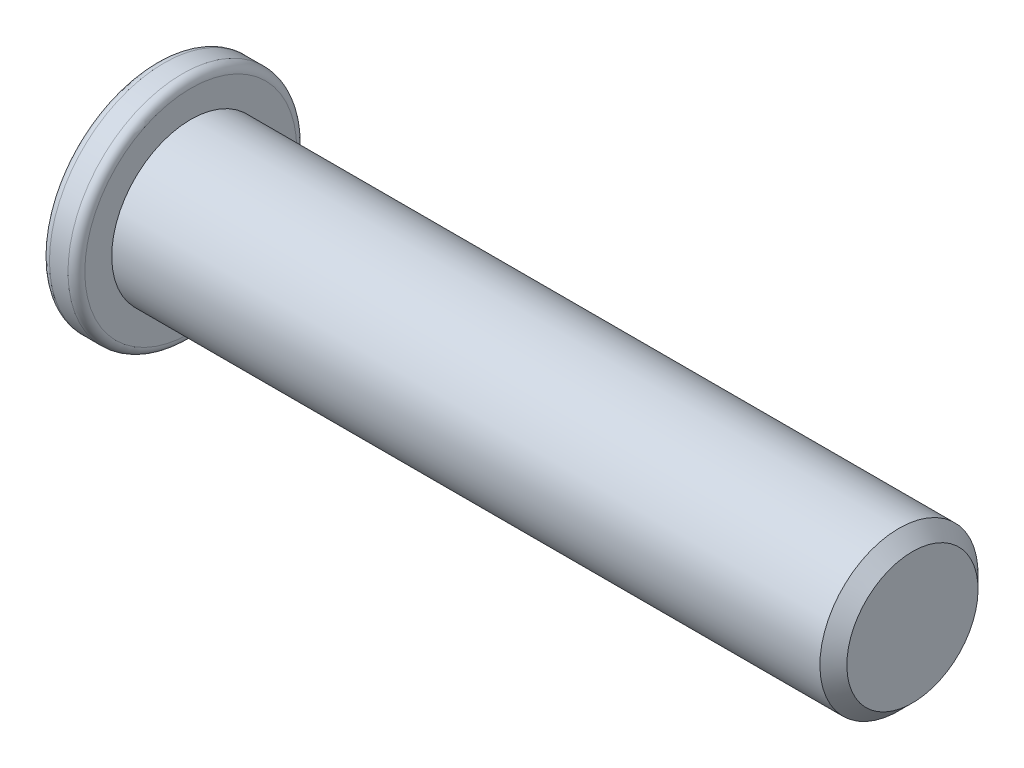
from build123d import *

# Parameters (mm, degrees)
FILLET1_R     = 0.5
CHAMFER1_SIZE = 0.8


with BuildPart() as part:
    # Sketch1 → Revolve1 (revolve)
    with BuildSketch(Plane.XY):
        Polygon((0, 0), (0, 6.8), (2.1, 6.8), (2.1, 4.7), (45, 4.7), (45, 0), align=None)
    revolve(axis=Axis((45, 0, 0), (-1, 0, 0)))

    # Fillet1
    fillet1_edges = [part.edges().sort_by_distance(p)[0] for p in [
        (2.1, -6.8, 0),
        (0, -6.8, 0),
    ]]
    fillet(fillet1_edges, radius=FILLET1_R)

    # Chamfer1
    chamfer1_edges = [part.edges().sort_by_distance(p)[0] for p in [
        (45, -4.7, 0),
    ]]
    chamfer(chamfer1_edges, length=CHAMFER1_SIZE)


solid = part.part
